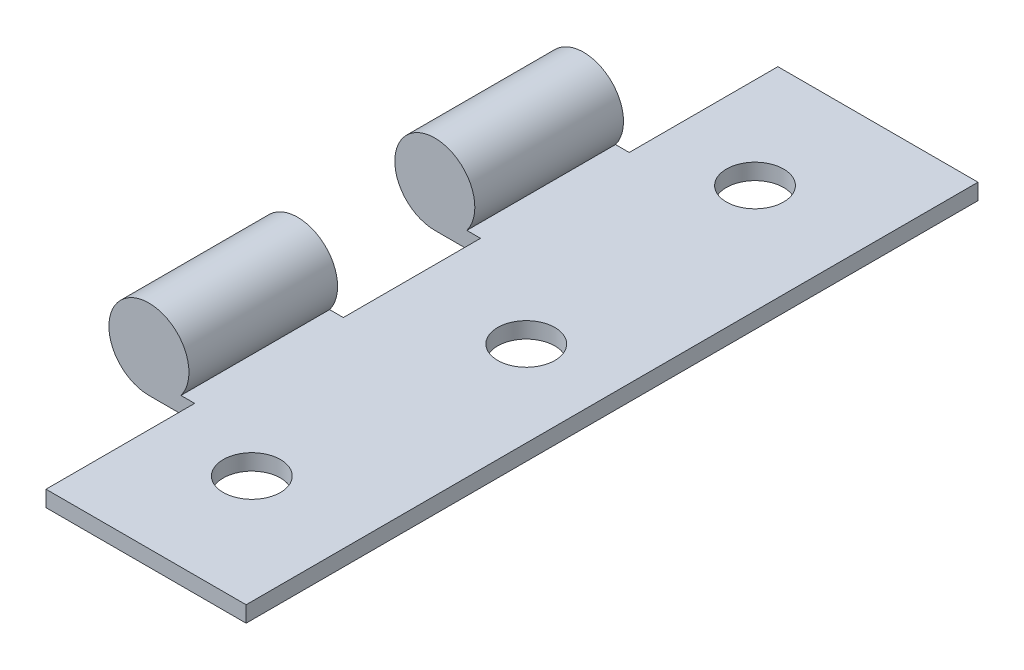
from build123d import *

# Parameters (mm, degrees)
BOSS_EXTRUDE1_DEPTH = 64
SKETCH2_R           = 2.499999953
CUT_EXTRUDE2_DEPTH  = 5
SKETCH3_W           = 8
SKETCH3_H           = 13
SKETCH3_H_2         = 12
CUT_EXTRUDE3_DEPTH  = 15


with BuildPart() as part:
    # Sketch1 → Boss-Extrude1 (new body)
    with BuildSketch(Plane.XY):
        with BuildLine():
            Line((0, 0), (21.499999926, 0))
            Line((21.499999926, 0), (21.499999926, 1.4))
            Line((21.499999926, 1.4), (2.799999992, 1.4))
            ThreePointArc((2.799999992, 1.4), (-1.565247581, 6.630495138), (0, 0))
        make_face()
    extrude(amount=BOSS_EXTRUDE1_DEPTH)

    # Sketch2 → Cut-Extrude2 (cut)
    with BuildSketch(Plane(origin=(0, 0, 0), x_dir=(1, 0, 0), z_dir=(0, 1, 0))):
        with Locations(Location((11.999999876, -53.99999995, 0), (0, 0, 90))):
            Circle(SKETCH2_R)
        with Locations(Location((13.999999876, -32.000000008, 0), (0, 0, 90))):
            Circle(SKETCH2_R)
        with Locations(Location((11.999999876, -10.000000066, 0), (0, 0, 90))):
            Circle(SKETCH2_R)
    extrude(amount=CUT_EXTRUDE2_DEPTH, mode=Mode.SUBTRACT)

    # Sketch3 → Cut-Extrude3 (cut)
    with BuildSketch(Plane(origin=(0, 0, 0), x_dir=(1, 0, 0), z_dir=(0, 1, 0))):
        with Locations((0, -6.5)):
            Rectangle(SKETCH3_W, SKETCH3_H)
        with Locations((0, -32)):
            Rectangle(SKETCH3_W, SKETCH3_H_2)
        with Locations((0, -57.5)):
            Rectangle(SKETCH3_W, SKETCH3_H)
    extrude(amount=CUT_EXTRUDE3_DEPTH, mode=Mode.SUBTRACT)


solid = part.part
